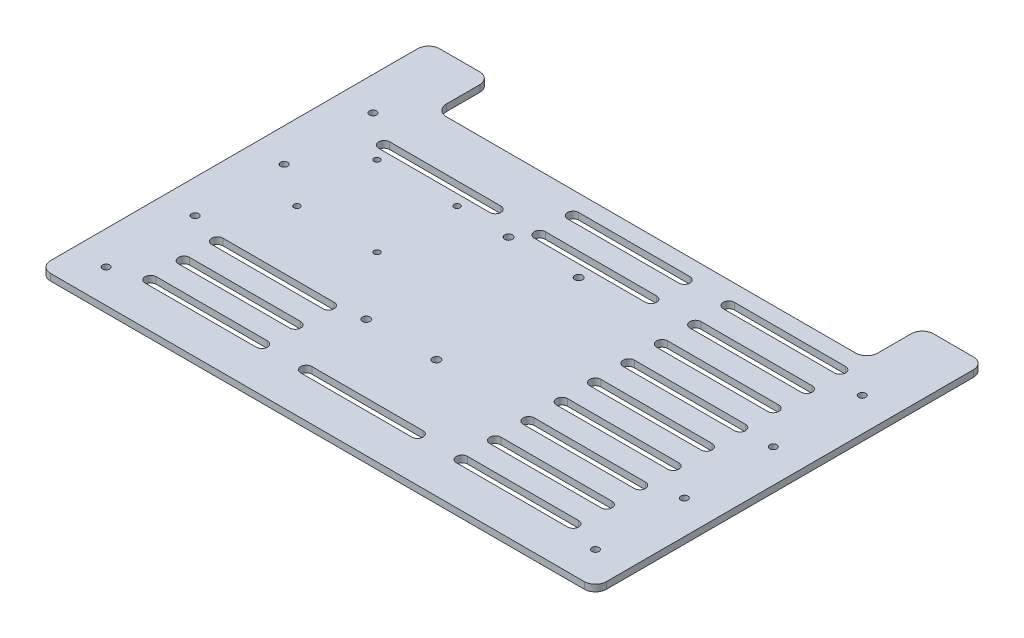
from build123d import *

# Parameters (mm, degrees)
EXTRUDE_1_DEPTH     = 3
FILLET_1_R          = 5
SKETCH_4_R          = 1.75
SKETCH_4_R_2        = 1.35
CUT_EXTRUDE_2_DEPTH = 10
CUT_EXTRUDE_3_DEPTH = 10
SKETCH_5_R          = 1.6
CUT_EXTRUDE_4_DEPTH = 10


with BuildPart() as part:
    # 草图1 → 凸台-拉伸1 (new body)
    with BuildSketch(Plane(origin=(0, 0, 0), x_dir=(1, 0, 0), z_dir=(0, 1, 0))):
        Polygon((-84.734156599, 82.359506041), (109.265843401, 82.359506041), (109.265843401, 107.359506041), (137.265843401, 107.359506041), (137.265843401, 82.359506041), (137.265843401, -67.640493959), (-112.734156599, -67.640493959), (-112.734156599, 55.552013884), (-112.734156599, 107.359506041), (-84.734156599, 107.359506041), align=None)
    extrude(amount=EXTRUDE_1_DEPTH)

    # 圆角1
    fillet_1_edges = [part.edges().sort_by_distance(p)[0] for p in [
        (137.265843401, 1.5, 67.640493959),
        (-112.734156599, 1.5, 67.640493959),
        (137.265843401, 1.5, -107.359506041),
        (109.265843401, 1.5, -107.359506041),
        (109.265843401, 1.5, -82.359506041),
        (-112.734156599, 1.5, -107.359506041),
        (-84.734156599, 1.5, -107.359506041),
        (-84.734156599, 1.5, -82.359506041),
    ]]
    fillet(fillet_1_edges, radius=FILLET_1_R)

    # 草图4 → 切除-拉伸2 (cut)
    with BuildSketch(Plane(origin=(0, 3, 0), x_dir=(1, 0, 0), z_dir=(0, 1, 0))):
        with Locations((-18.891317384, -14.5)):
            Circle(SKETCH_4_R)
        with Locations((12.608682616, -14.5)):
            Circle(SKETCH_4_R)
        with Locations((-42.582797937, 49.995)):
            Circle(SKETCH_4_R_2)
        with Locations((-18.891317384, 49.5)):
            Circle(SKETCH_4_R)
        with Locations((12.608682616, 49.5)):
            Circle(SKETCH_4_R)
        with Locations((-42.582797937, 13.995)):
            Circle(SKETCH_4_R_2)
        with Locations((-78.582797937, 13.995)):
            Circle(SKETCH_4_R_2)
        with Locations((-78.582797937, 49.995)):
            Circle(SKETCH_4_R_2)
    extrude(amount=-CUT_EXTRUDE_2_DEPTH, mode=Mode.SUBTRACT)

    # 草图4<3> → 切除-拉伸3 (cut)
    with BuildSketch(Plane(origin=(0, 3, 0), x_dir=(1, 0, 0), z_dir=(0, 1, 0))):
        with BuildLine():
            Line((57.265843401, 74.859506041), (107.265843401, 74.859506041))
            ThreePointArc((107.265843401, 74.859506041), (109.765843401, 72.359506041), (107.265843401, 69.859506041))
            Line((107.265843401, 69.859506041), (57.265843401, 69.859506041))
            ThreePointArc((57.265843401, 69.859506041), (54.765843401, 72.359506041), (57.265843401, 74.859506041))
        make_face()
        with BuildLine():
            Line((57.265843401, 59.859506041), (107.265843401, 59.859506041))
            ThreePointArc((107.265843401, 59.859506041), (109.765843401, 57.359506041), (107.265843401, 54.859506041))
            Line((107.265843401, 54.859506041), (57.265843401, 54.859506041))
            ThreePointArc((57.265843401, 54.859506041), (54.765843401, 57.359506041), (57.265843401, 59.859506041))
        make_face()
        with BuildLine():
            Line((57.265843401, 44.859506041), (107.265843401, 44.859506041))
            ThreePointArc((107.265843401, 44.859506041), (109.765843401, 42.359506041), (107.265843401, 39.859506041))
            Line((107.265843401, 39.859506041), (57.265843401, 39.859506041))
            ThreePointArc((57.265843401, 39.859506041), (54.765843401, 42.359506041), (57.265843401, 44.859506041))
        make_face()
        with BuildLine():
            Line((57.265843401, 29.859506041), (107.265843401, 29.859506041))
            ThreePointArc((107.265843401, 29.859506041), (109.765843401, 27.359506041), (107.265843401, 24.859506041))
            Line((107.265843401, 24.859506041), (57.265843401, 24.859506041))
            ThreePointArc((57.265843401, 24.859506041), (54.765843401, 27.359506041), (57.265843401, 29.859506041))
        make_face()
        with BuildLine():
            Line((57.265843401, 14.859506041), (107.265843401, 14.859506041))
            ThreePointArc((107.265843401, 14.859506041), (109.765843401, 12.359506041), (107.265843401, 9.859506041))
            Line((107.265843401, 9.859506041), (57.265843401, 9.859506041))
            ThreePointArc((57.265843401, 9.859506041), (54.765843401, 12.359506041), (57.265843401, 14.859506041))
        make_face()
        with BuildLine():
            Line((57.265843401, -0.140493959), (107.265843401, -0.140493959))
            ThreePointArc((107.265843401, -0.140493959), (109.765843401, -2.640493959), (107.265843401, -5.140493959))
            Line((107.265843401, -5.140493959), (57.265843401, -5.140493959))
            ThreePointArc((57.265843401, -5.140493959), (54.765843401, -2.640493959), (57.265843401, -0.140493959))
        make_face()
        with BuildLine():
            Line((57.265843401, -15.140493959), (107.265843401, -15.140493959))
            ThreePointArc((107.265843401, -15.140493959), (109.765843401, -17.640493959), (107.265843401, -20.140493959))
            Line((107.265843401, -20.140493959), (57.265843401, -20.140493959))
            ThreePointArc((57.265843401, -20.140493959), (54.765843401, -17.640493959), (57.265843401, -15.140493959))
        make_face()
        with BuildLine():
            Line((57.265843401, -30.140493959), (107.265843401, -30.140493959))
            ThreePointArc((107.265843401, -30.140493959), (109.765843401, -32.640493959), (107.265843401, -35.140493959))
            Line((107.265843401, -35.140493959), (57.265843401, -35.140493959))
            ThreePointArc((57.265843401, -35.140493959), (54.765843401, -32.640493959), (57.265843401, -30.140493959))
        make_face()
        with BuildLine():
            Line((57.265843401, -45.140493959), (107.265843401, -45.140493959))
            ThreePointArc((107.265843401, -45.140493959), (109.765843401, -47.640493959), (107.265843401, -50.140493959))
            Line((107.265843401, -50.140493959), (57.265843401, -50.140493959))
            ThreePointArc((57.265843401, -50.140493959), (54.765843401, -47.640493959), (57.265843401, -45.140493959))
        make_face()
        with BuildLine():
            Line((-12.734156599, 74.859506041), (37.265843401, 74.859506041))
            ThreePointArc((37.265843401, 74.859506041), (39.765843401, 72.359506041), (37.265843401, 69.859506041))
            Line((37.265843401, 69.859506041), (-12.734156599, 69.859506041))
            ThreePointArc((-12.734156599, 69.859506041), (-15.234156599, 72.359506041), (-12.734156599, 74.859506041))
        make_face()
        with BuildLine():
            Line((-12.734156599, 59.859506041), (37.265843401, 59.859506041))
            ThreePointArc((37.265843401, 59.859506041), (39.765843401, 57.359506041), (37.265843401, 54.859506041))
            Line((37.265843401, 54.859506041), (-12.734156599, 54.859506041))
            ThreePointArc((-12.734156599, 54.859506041), (-15.234156599, 57.359506041), (-12.734156599, 59.859506041))
        make_face()
        with BuildLine():
            Line((-82.734156599, 59.859506041), (-32.734156599, 59.859506041))
            ThreePointArc((-32.734156599, 59.859506041), (-30.234156599, 57.359506041), (-32.734156599, 54.859506041))
            Line((-32.734156599, 54.859506041), (-82.734156599, 54.859506041))
            ThreePointArc((-82.734156599, 54.859506041), (-85.234156599, 57.359506041), (-82.734156599, 59.859506041))
        make_face()
        with BuildLine():
            Line((-12.734156599, -45.140493959), (37.265843401, -45.140493959))
            ThreePointArc((37.265843401, -45.140493959), (39.765843401, -47.640493959), (37.265843401, -50.140493959))
            Line((37.265843401, -50.140493959), (-12.734156599, -50.140493959))
            ThreePointArc((-12.734156599, -50.140493959), (-15.234156599, -47.640493959), (-12.734156599, -45.140493959))
        make_face()
        with BuildLine():
            Line((-82.734156599, -45.140493959), (-32.734156599, -45.140493959))
            ThreePointArc((-32.734156599, -45.140493959), (-30.234156599, -47.640493959), (-32.734156599, -50.140493959))
            Line((-32.734156599, -50.140493959), (-82.734156599, -50.140493959))
            ThreePointArc((-82.734156599, -50.140493959), (-85.234156599, -47.640493959), (-82.734156599, -45.140493959))
        make_face()
        with BuildLine():
            Line((-82.734156599, -30.140493959), (-32.734156599, -30.140493959))
            ThreePointArc((-32.734156599, -30.140493959), (-30.234156599, -32.640493959), (-32.734156599, -35.140493959))
            Line((-32.734156599, -35.140493959), (-82.734156599, -35.140493959))
            ThreePointArc((-82.734156599, -35.140493959), (-85.234156599, -32.640493959), (-82.734156599, -30.140493959))
        make_face()
        with BuildLine():
            Line((-82.734156599, -15.140493959), (-32.734156599, -15.140493959))
            ThreePointArc((-32.734156599, -15.140493959), (-30.234156599, -17.640493959), (-32.734156599, -20.140493959))
            Line((-32.734156599, -20.140493959), (-82.734156599, -20.140493959))
            ThreePointArc((-82.734156599, -20.140493959), (-85.234156599, -17.640493959), (-82.734156599, -15.140493959))
        make_face()
    extrude(amount=-CUT_EXTRUDE_3_DEPTH, mode=Mode.SUBTRACT)

    # 草图5 → 切除-拉伸4 (cut)
    with BuildSketch(Plane(origin=(0, 3, 0), x_dir=(1, 0, 0), z_dir=(0, 1, 0))):
        with Locations((-97.734156599, 67.359506041)):
            Circle(SKETCH_5_R)
        with Locations((-97.734156599, 27.359506041)):
            Circle(SKETCH_5_R)
        with Locations((-97.734156599, -12.640493959)):
            Circle(SKETCH_5_R)
        with Locations((-97.734156599, -52.640493959)):
            Circle(SKETCH_5_R)
        with Locations((122.265843401, -52.640493959)):
            Circle(SKETCH_5_R)
        with Locations((122.265843401, -12.640493959)):
            Circle(SKETCH_5_R)
        with Locations((122.265843401, 27.359506041)):
            Circle(SKETCH_5_R)
        with Locations((122.265843401, 67.359506041)):
            Circle(SKETCH_5_R)
    extrude(amount=-CUT_EXTRUDE_4_DEPTH, mode=Mode.SUBTRACT)


solid = part.part
